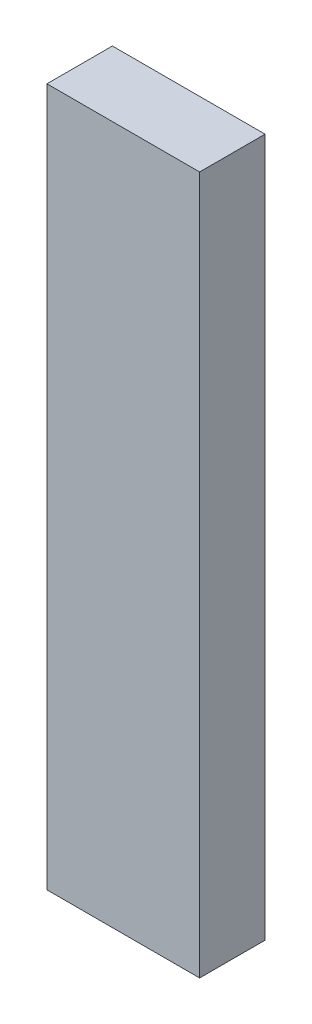
from build123d import *

# Parameters (mm, degrees)
SKETCH1_W           = 88.9
SKETCH1_H           = 38.1
BOSS_EXTRUDE1_DEPTH = 406.4


with BuildPart() as part:
    # Sketch1 → Boss-Extrude1 (new body)
    with BuildSketch(Plane(origin=(0, 0, 0), x_dir=(1, 0, 0), z_dir=(0, 1, 0))):
        with Locations((44.45, 19.05)):
            Rectangle(SKETCH1_W, SKETCH1_H)
    extrude(amount=BOSS_EXTRUDE1_DEPTH)


solid = part.part
